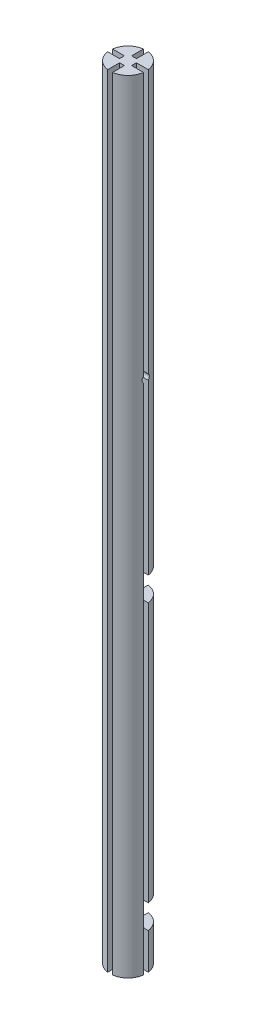
from build123d import *

# Parameters (mm, degrees)
BOSS_EXTRUDE2_DEPTH     = 4000
CUT_EXTRUDE1_START      = 200
SKETCH2_W               = 74.330343737
SKETCH2_H               = 74.330343737
CUT_EXTRUDE1_DEPTH      = 50
CUT_EXTRUDE2_START      = 1380
SKETCH2_2_W             = 74.330343737
SKETCH2_2_H             = 74.330343737
CUT_EXTRUDE2_DEPTH      = 50
SKETCH3_R               = 15.2
CUT_EXTRUDE3_DEPTH      = 49.330343737
SKETCH4_R               = 15.2
CUT_EXTRUDE4_DEPTH      = 49.330343737
CUT_EXTRUDE5_DEPTH      = 4002.923477282
CUT_EXTRUDE5_DEPTH_BACK = 4002.923477282
SKETCH5_W               = 148.660687474
SKETCH5_H               = 750


with BuildPart() as part:
    # Sketch1 → Boss-Extrude2 (new body)
    with BuildSketch(Plane(origin=(0, 0, 0), x_dir=(1, 0, 0), z_dir=(0, 1, 0))):
        with BuildLine():
            Line((-10, 74.330343737), (-10, 25))
            Line((-10, 25), (10, 25))
            Line((10, 25), (10, 74.330343737))
            ThreePointArc((10, 74.330343737), (53.033008589, 53.033008589), (74.330343737, 10))
            Line((74.330343737, 10), (25, 10))
            Line((25, 10), (25, -10))
            Line((25, -10), (74.330343737, -10))
            ThreePointArc((74.330343737, -10), (53.033008589, -53.033008589), (10, -74.330343737))
            Line((10, -74.330343737), (10, -25))
            Line((10, -25), (-10, -25))
            Line((-10, -25), (-10, -74.330343737))
            ThreePointArc((-10, -74.330343737), (-53.033008589, -53.033008589), (-74.330343737, -10))
            Line((-74.330343737, -10), (-25, -10))
            Line((-25, -10), (-25, 10))
            Line((-25, 10), (-74.330343737, 10))
            ThreePointArc((-74.330343737, 10), (-53.033008589, 53.033008589), (-10, 74.330343737))
        make_face()
    extrude(amount=BOSS_EXTRUDE2_DEPTH)

    # Sketch2 → Cut-Extrude1 (cut, symmetric)
    with BuildSketch(Plane(origin=(0, 0, 0), x_dir=(1, 0, 0), z_dir=(0, 1, 0)).offset(CUT_EXTRUDE1_START)):
        with Locations((37.165171869, 37.165171869)):
            Rectangle(SKETCH2_W, SKETCH2_H)
    extrude(amount=CUT_EXTRUDE1_DEPTH, both=True, mode=Mode.SUBTRACT)

    # Sketch2<2> → Cut-Extrude2 (cut, symmetric)
    with BuildSketch(Plane(origin=(0, 0, 0), x_dir=(1, 0, 0), z_dir=(0, 1, 0)).offset(CUT_EXTRUDE2_START)):
        with Locations((37.165171869, 37.165171869)):
            Rectangle(SKETCH2_2_W, SKETCH2_2_H)
    extrude(amount=CUT_EXTRUDE2_DEPTH, both=True, mode=Mode.SUBTRACT)

    # Sketch3 → Cut-Extrude3 (cut)
    with BuildSketch(Plane(origin=(74.330343737, 0, 0), x_dir=(0, 0, -1), z_dir=(1, 0, 0))):
        with Locations((0, 2143)):
            Circle(SKETCH3_R)
    extrude(amount=-CUT_EXTRUDE3_DEPTH, mode=Mode.SUBTRACT)

    # Sketch4 → Cut-Extrude4 (cut)
    with BuildSketch(Plane(origin=(0, 0, -74.330343737), x_dir=(-1, 0, 0), z_dir=(0, 0, -1))):
        with Locations((0, 2143)):
            Circle(SKETCH4_R)
    extrude(amount=-CUT_EXTRUDE4_DEPTH, mode=Mode.SUBTRACT)

    # Sketch5 → Cut-Extrude5 (cut, two sides: drawn at the far end of the back side and taken through both)
    with BuildSketch(Plane.XY.offset(25).offset(-CUT_EXTRUDE5_DEPTH_BACK)):
        with Locations((0, 3625)):
            Rectangle(SKETCH5_W, SKETCH5_H)
    extrude(amount=CUT_EXTRUDE5_DEPTH + CUT_EXTRUDE5_DEPTH_BACK, mode=Mode.SUBTRACT)


solid = part.part
